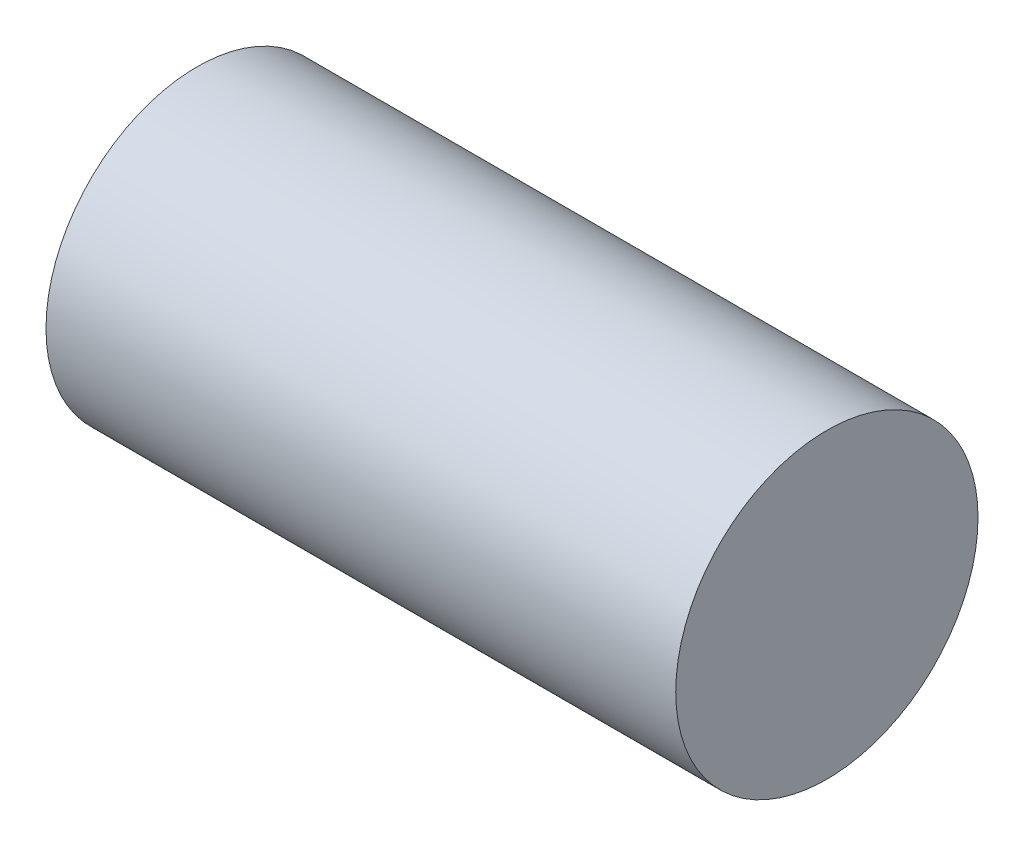
from build123d import *

# Parameters (mm, degrees)
HOSE_END_8_SKETCH_W = 50
HOSE_END_8_SKETCH_H = 12
SOCKET_1_SKETCH_W   = 23.9
SOCKET_1_SKETCH_H   = 6.35


with BuildPart() as part:
    # Hose_End_8 Sketch → Hose_End_8 (revolve)
    with BuildSketch(Plane.XY):
        with Locations((25, 6)):
            Rectangle(HOSE_END_8_SKETCH_W, HOSE_END_8_SKETCH_H)
    revolve(axis=Axis((-1000, 0, 0), (1, 0, 0)))

    # Socket 1 Sketch → Socket 1 (revolve, cut)
    with BuildSketch(Plane.XY):
        with Locations((10.95, 3.175)):
            Rectangle(SOCKET_1_SKETCH_W, SOCKET_1_SKETCH_H)
    revolve(axis=Axis((-1000, 0, 0), (1, 0, 0)), mode=Mode.SUBTRACT)


solid = part.part
